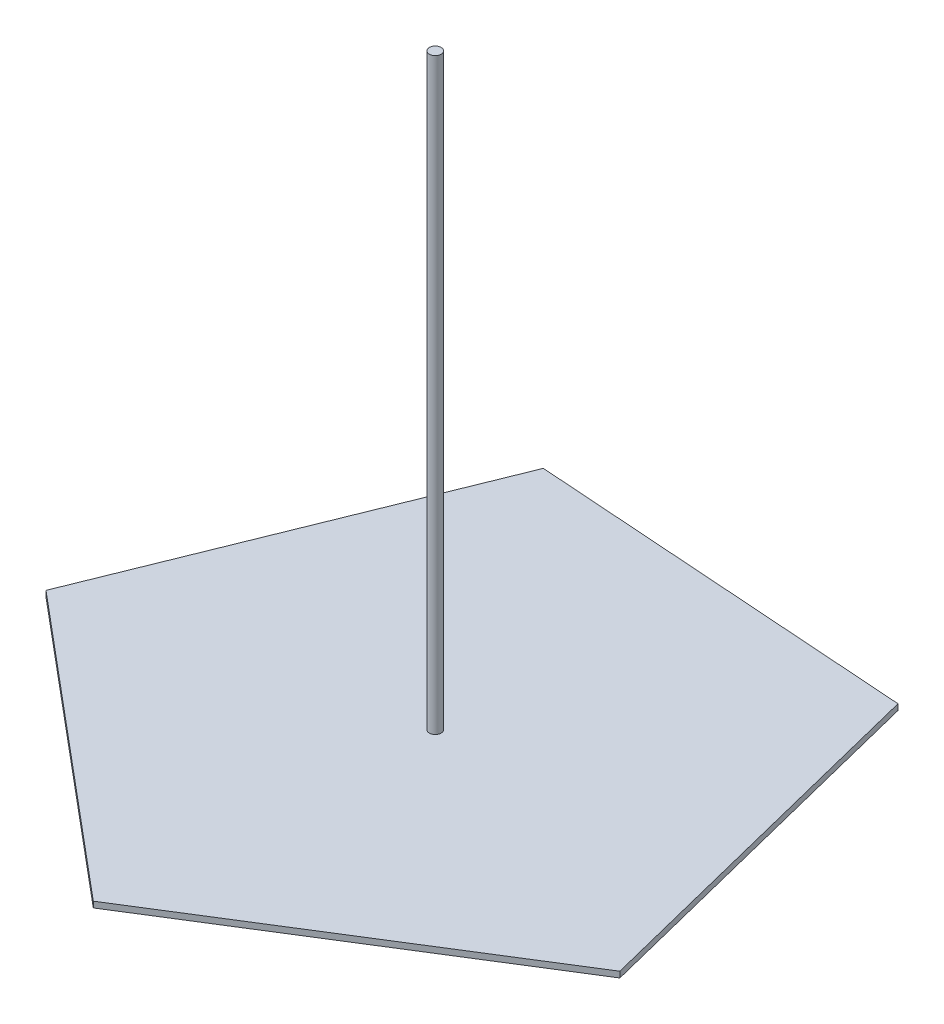
from build123d import *

# Parameters (mm, degrees)
BOSS_EXTRUDE3_DEPTH = 2.54
SKETCH4_R           = 2.54
BOSS_EXTRUDE4_DEPTH = 254


with BuildPart() as part:
    # Sketch3 → Boss-Extrude3 (new body)
    with BuildSketch(Plane(origin=(0, 0, 0), x_dir=(1, 0, 0), z_dir=(0, 1, 0))):
        Polygon((90.212065812, 107.592372069), (-74.449365126, 119.044644473), (-136.224303901, -34.018735606), (-9.741884778, -140.069379332), (130.203487993, -52.548901604), align=None)
    extrude(amount=BOSS_EXTRUDE3_DEPTH)

    # Sketch4 → Boss-Extrude4 (add)
    with BuildSketch(Plane(origin=(0, 2.54, 0), x_dir=(1, 0, 0), z_dir=(0, 1, 0))):
        with Locations(Location((0, -2.079529354, 0), (0, 0, 270))):
            Circle(SKETCH4_R)
    extrude(amount=BOSS_EXTRUDE4_DEPTH)


solid = part.part
